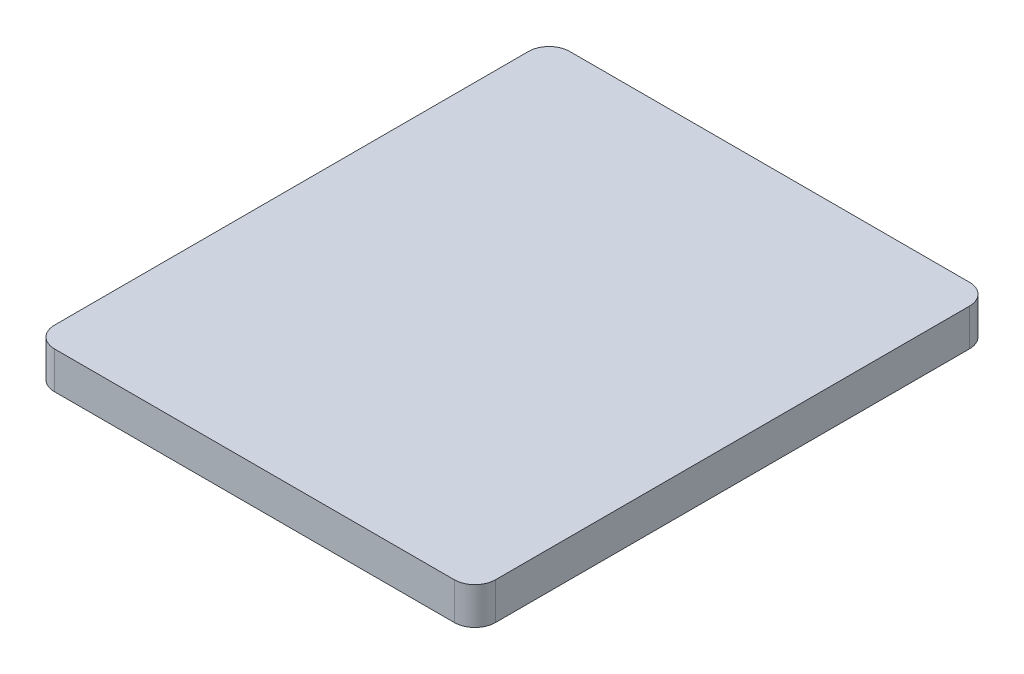
from build123d import *

# Parameters (mm, degrees)
SKETCH_1_W      = 214
SKETCH_1_H      = 250
EXTRUDE_1_DEPTH = 18
FILLET_1_R      = 10


with BuildPart() as part:
    # 草图1 → 凸台-拉伸1 (new body)
    with BuildSketch(Plane(origin=(0, 0, 0), x_dir=(1, 0, 0), z_dir=(0, 1, 0))):
        Rectangle(SKETCH_1_W, SKETCH_1_H)
    extrude(amount=EXTRUDE_1_DEPTH)

    # 圆角1
    fillet_1_edges = [part.edges().sort_by_distance(p)[0] for p in [
        (-107, 9, -125),
        (107, 9, -125),
        (107, 9, 125),
        (-107, 9, 125),
    ]]
    fillet(fillet_1_edges, radius=FILLET_1_R)


solid = part.part
